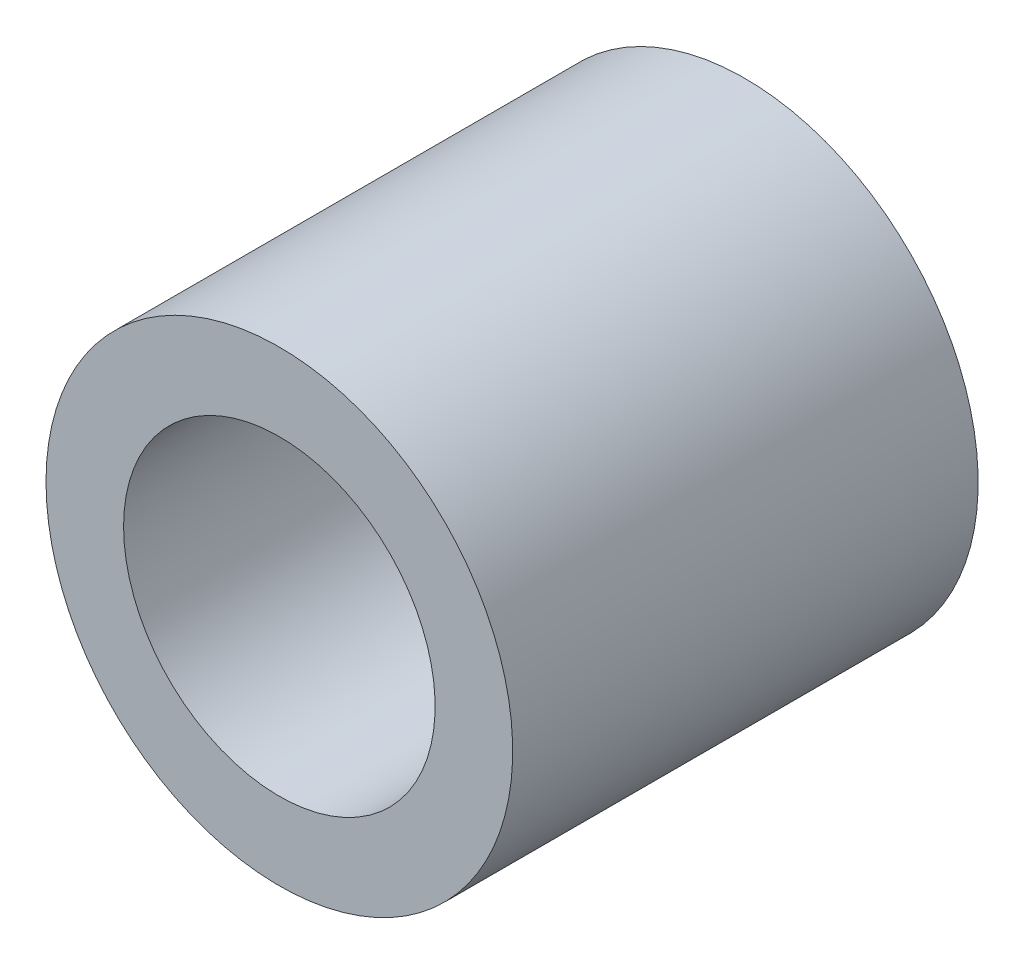
from build123d import *

# Parameters (mm, degrees)
BOSS_EXTRUDE1_DEPTH      = 4.7625
BOSS_EXTRUDE1_DEPTH_BACK = 4.7625
SKETCH5_R                = 4.7752
SKETCH5_R_2              = 3.1877


with BuildPart() as part:
    # Sketch5 → Boss-Extrude1 (new, two sides: drawn at the far end of the back side and taken through both)
    with BuildSketch(Plane.XY.offset(-BOSS_EXTRUDE1_DEPTH_BACK)):
        with Locations(Location((0, 0, 0), (0, 0, 180))):
            Circle(SKETCH5_R)
        with Locations(Location((0, 0, 0), (0, 0, 180))):
            Circle(SKETCH5_R_2, mode=Mode.SUBTRACT)
    extrude(amount=BOSS_EXTRUDE1_DEPTH + BOSS_EXTRUDE1_DEPTH_BACK)


solid = part.part
